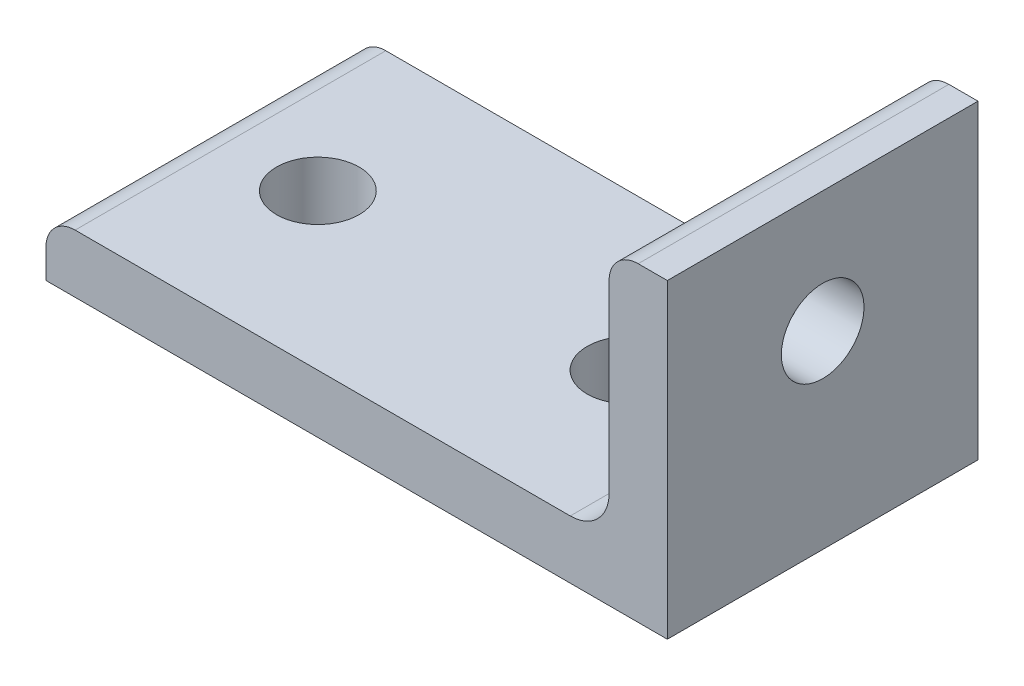
from build123d import *

# Parameters (mm, degrees)
BOSS_EXTRUDE1_DEPTH     = 12.7
F_1_4_CLEARANCE_HOLE1_D = 6.7564
F_1_4_CLEARANCE_HOLE2_D = 6.7564


with BuildPart() as part:
    # Sketch2 → Boss-Extrude1 (new, symmetric)
    with BuildSketch(Plane.XY):
        with BuildLine():
            Line((-25.4, -12.7), (25.4, -12.7))
            Line((25.4, -12.7), (25.4, 12.7))
            Line((25.4, 12.7), (23.01875, 12.7))
            ThreePointArc((23.01875, 12.7), (21.334951977, 12.002548023), (20.6375, 10.31875))
            Line((20.6375, 10.31875), (20.6375, -4.7625))
            ThreePointArc((20.6375, -4.7625), (19.70756403, -7.00756403), (17.4625, -7.9375))
            Line((17.4625, -7.9375), (-23.01875, -7.9375))
            ThreePointArc((-23.01875, -7.9375), (-24.702548023, -8.634951977), (-25.4, -10.31875))
            Line((-25.4, -10.31875), (-25.4, -12.7))
        make_face()
    extrude(amount=BOSS_EXTRUDE1_DEPTH, both=True)

    # 1/4 Clearance Hole1 (through all)
    with Locations(Plane.ZY.offset(-20.6375)):
        with Locations((0, 2.778125)):
            Hole(F_1_4_CLEARANCE_HOLE1_D / 2)

    # 1/4 Clearance Hole2 (through all)
    with Locations(Plane(origin=(0, -7.9375, 0), x_dir=(1, 0, 0), z_dir=(0, 1, 0))):
        with Locations((9.525, 0), (-15.875, 0)):
            Hole(F_1_4_CLEARANCE_HOLE2_D / 2)


solid = part.part
